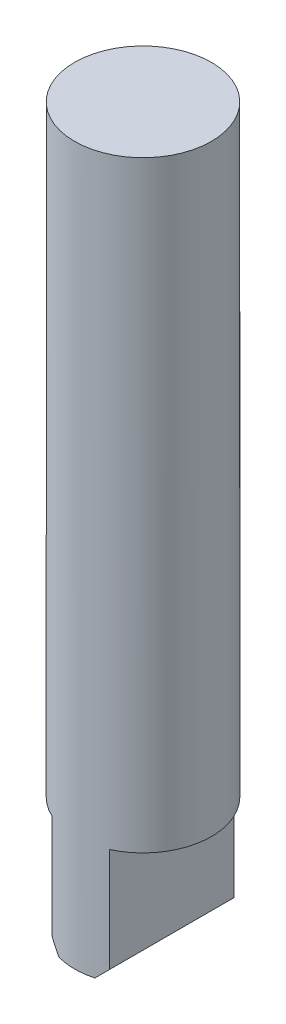
from build123d import *

# Parameters (mm, degrees)
SKETCH1_R           = 4.775
BOSS_EXTRUDE1_DEPTH = 50
CUT_EXTRUDE2_DEPTH  = 8
CHAMFER2_SIZE       = 0.75


with BuildPart() as part:
    # Sketch1 → Boss-Extrude1 (new body)
    with BuildSketch(Plane(origin=(0, 0, 0), x_dir=(1, 0, 0), z_dir=(0, 1, 0))):
        with Locations(Location((0, 0, 0), (0, 0, 270))):
            Circle(SKETCH1_R)
    extrude(amount=BOSS_EXTRUDE1_DEPTH)

    # Sketch3 → Cut-Extrude2 (cut)
    with BuildSketch(Plane.XZ):
        with BuildLine():
            ThreePointArc((5.7947785, 0), (4.752316007, 3.315863452), (2, 5.438700016))
            Line((2, 5.438700016), (2, 4.33596875))
            ThreePointArc((2, 4.33596875), (4.021854361, 2.57396824), (4.775, 0))
            ThreePointArc((4.775, 0), (4.021854361, -2.57396824), (2, -4.33596875))
            Line((2, -4.33596875), (2, -5.438700016))
            ThreePointArc((2, -5.438700016), (4.752316007, -3.315863452), (5.7947785, 0))
        make_face()
        with BuildLine():
            ThreePointArc((4.775, 0), (4.021854361, 2.57396824), (2, 4.33596875))
            Line((2, 4.33596875), (2, -4.33596875))
            ThreePointArc((2, -4.33596875), (4.021854361, -2.57396824), (4.775, 0))
        make_face()
        with BuildLine():
            Line((-2, -4.33596875), (-2, 4.33596875))
            ThreePointArc((-2, 4.33596875), (-4.775, 0), (-2, -4.33596875))
        make_face()
        with BuildLine():
            Line((-2, 4.33596875), (-2, 5.438700016))
            ThreePointArc((-2, 5.438700016), (-5.7947785, 0), (-2, -5.438700016))
            Line((-2, -5.438700016), (-2, -4.33596875))
            ThreePointArc((-2, -4.33596875), (-4.775, 0), (-2, 4.33596875))
        make_face()
    extrude(amount=-CUT_EXTRUDE2_DEPTH, mode=Mode.SUBTRACT)

    # Chamfer2
    chamfer2_edges = [part.edges().sort_by_distance(p)[0] for p in [
        (-2, 0, 0),
        (2, 0, 0),
    ]]
    chamfer(chamfer2_edges, length=CHAMFER2_SIZE)


solid = part.part
